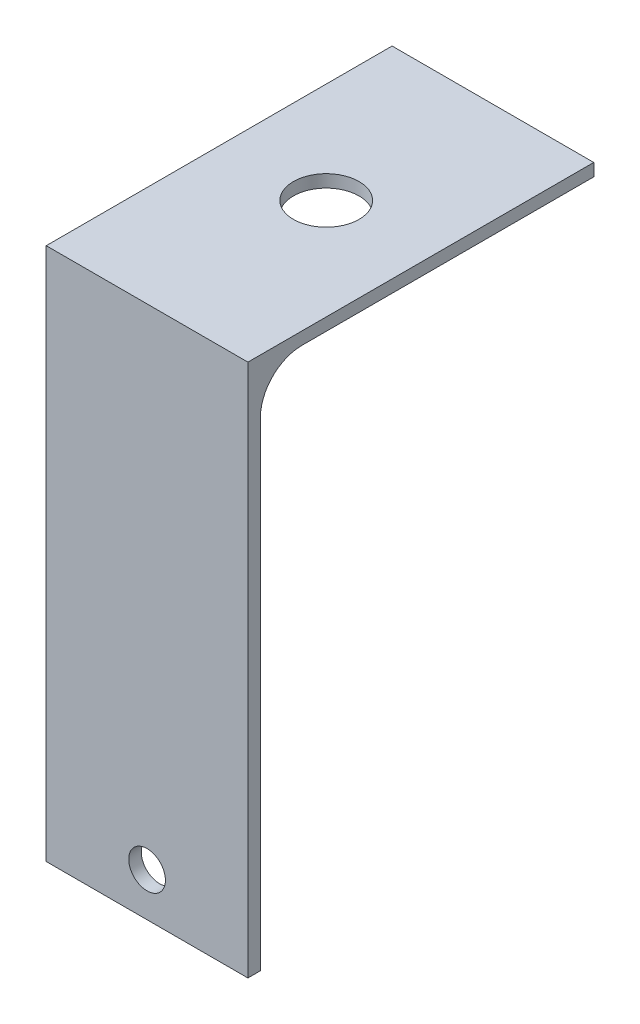
from build123d import *

# Parameters (mm, degrees)
SKETCH1_W           = 24.2
SKETCH1_H           = 64
BOSS_EXTRUDE1_DEPTH = 1.5
SKETCH2_R           = 2.2
CUT_EXTRUDE1_DEPTH  = 35.244123583
SKETCH4_W           = 24.2
SKETCH4_H           = 40
BOSS_EXTRUDE2_DEPTH = 1.5
SKETCH5_R           = 3.937
CUT_EXTRUDE2_DEPTH  = 76.184173867
FILLET1_R           = 5


with BuildPart() as part:
    # Sketch1 → Boss-Extrude1 (new body)
    with BuildSketch(Plane.XY):
        Rectangle(SKETCH1_W, SKETCH1_H)
    extrude(amount=BOSS_EXTRUDE1_DEPTH)

    # Sketch2 → Cut-Extrude1 (cut, through all)
    with BuildSketch(Plane.XY.offset(1.5)):
        with Locations((0, -26.8)):
            Circle(SKETCH2_R)
    extrude(amount=-CUT_EXTRUDE1_DEPTH, mode=Mode.SUBTRACT)

    # Sketch4 → Boss-Extrude2 (add)
    with BuildSketch(Plane(origin=(0, 32, 0), x_dir=(1, 0, 0), z_dir=(0, 1, 0))):
        with Locations((0, 20)):
            Rectangle(SKETCH4_W, SKETCH4_H)
    extrude(amount=-BOSS_EXTRUDE2_DEPTH)

    # Sketch5 → Cut-Extrude2 (cut, through all)
    with BuildSketch(Plane.XZ.offset(-30.5)):
        with Locations(Location((0, -20, 0), (0, 0, 270))):
            Circle(SKETCH5_R)
    extrude(amount=-CUT_EXTRUDE2_DEPTH, mode=Mode.SUBTRACT)

    # Fillet1
    fillet1_edges = [part.edges().sort_by_distance(p)[0] for p in [
        (0, 30.5, 0),
    ]]
    fillet(fillet1_edges, radius=FILLET1_R)


solid = part.part
